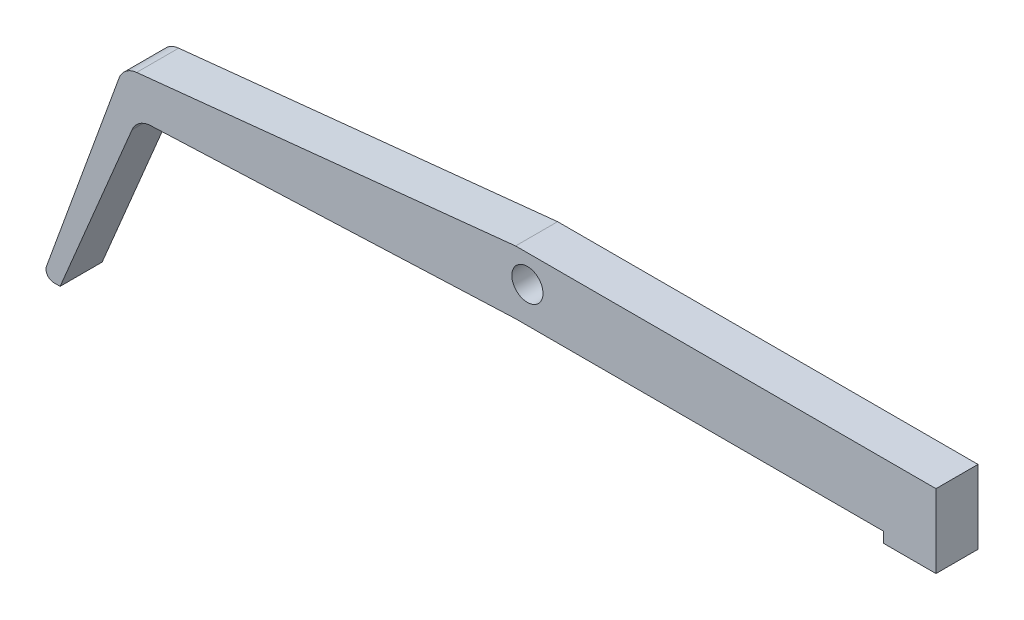
from build123d import *

# Parameters (mm, degrees)
BOSS_EXTRUDE1_DEPTH     = 8
SKETCH6_W               = 1.6
SKETCH6_H               = 2.4
BOSS_EXTRUDE2_DEPTH     = 2
FILLET1_R               = 4
CUT_EXTRUDE1_DEPTH      = 101.380345151
CUT_EXTRUDE1_DEPTH_BACK = 101.380345151
SKETCH7_R               = 2.966503931
FILLET3_R               = 1.5


with BuildPart() as part:
    # Sketch4 → Boss-Extrude1 (new body)
    with BuildSketch(Plane.XY):
        Polygon((77.746809309, 38.75), (-2.253190691, 38.75), (-76.855180537, 31.033581723), (-92.253190691, -11.25), (-88.923190691, -11.25), (-74.253190691, 23.75), (-2.253190691, 26.75), (77.746809309, 26.75), align=None)
    extrude(amount=BOSS_EXTRUDE1_DEPTH)

    # Sketch6 → Boss-Extrude2 (add)
    with BuildSketch(Plane.XZ.offset(-26.75)):
        Polygon((77.746809309, 6.4), (77.746809309, 8), (67.746809309, 8), (67.746809309, 6.4), (76.146809309, 6.4), align=None)
        with Locations((76.946809309, 5.2)):
            Rectangle(SKETCH6_W, SKETCH6_H)
        with Locations((76.946809309, 2.8)):
            Rectangle(SKETCH6_W, SKETCH6_H)
        Polygon((77.746809309, 0), (77.746809309, 1.6), (76.146809309, 1.6), (67.746809309, 1.6), (67.746809309, 0), align=None)
    extrude(amount=BOSS_EXTRUDE2_DEPTH)

    # Fillet1
    fillet1_edges = [part.edges().sort_by_distance(p)[0] for p in [
        (-74.253190691, 23.75, 4),
        (-76.855180537, 31.033581723, 4),
    ]]
    fillet(fillet1_edges, radius=FILLET1_R)

    # Sketch7 → Cut-Extrude1 (cut, two sides: drawn at the far end of the back side and taken through both)
    with BuildSketch(Plane.XY.offset(8).offset(-CUT_EXTRUDE1_DEPTH_BACK)):
        with Locations((0, 33.532902176)):
            Circle(SKETCH7_R)
    extrude(amount=CUT_EXTRUDE1_DEPTH + CUT_EXTRUDE1_DEPTH_BACK, mode=Mode.SUBTRACT)

    # Fillet3
    fillet3_edges = [part.edges().sort_by_distance(p)[0] for p in [
        (-92.253190691, -11.25, 4),
    ]]
    fillet(fillet3_edges, radius=FILLET3_R)


solid = part.part
